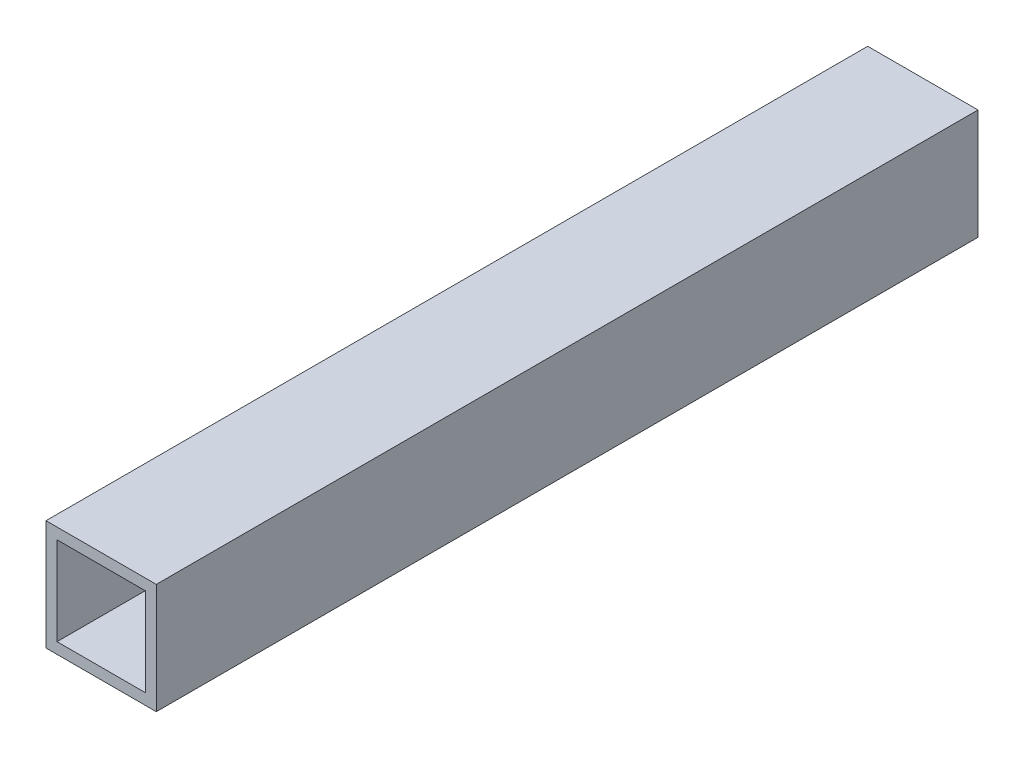
from build123d import *

# Parameters (mm, degrees)
SKETCH_1_W      = 40
SKETCH_1_H      = 40
SKETCH_1_W_2    = 32
SKETCH_1_H_2    = 32
EXTRUDE_1_DEPTH = 298


with BuildPart() as part:
    # Эскиз1 → Вытянуть-Тонкостенный1 (new body)
    with BuildSketch(Plane.XY):
        with Locations((20, 20)):
            Rectangle(SKETCH_1_W, SKETCH_1_H)
        with Locations((20, 20)):
            Rectangle(SKETCH_1_W_2, SKETCH_1_H_2, mode=Mode.SUBTRACT)
    extrude(amount=EXTRUDE_1_DEPTH)


solid = part.part
